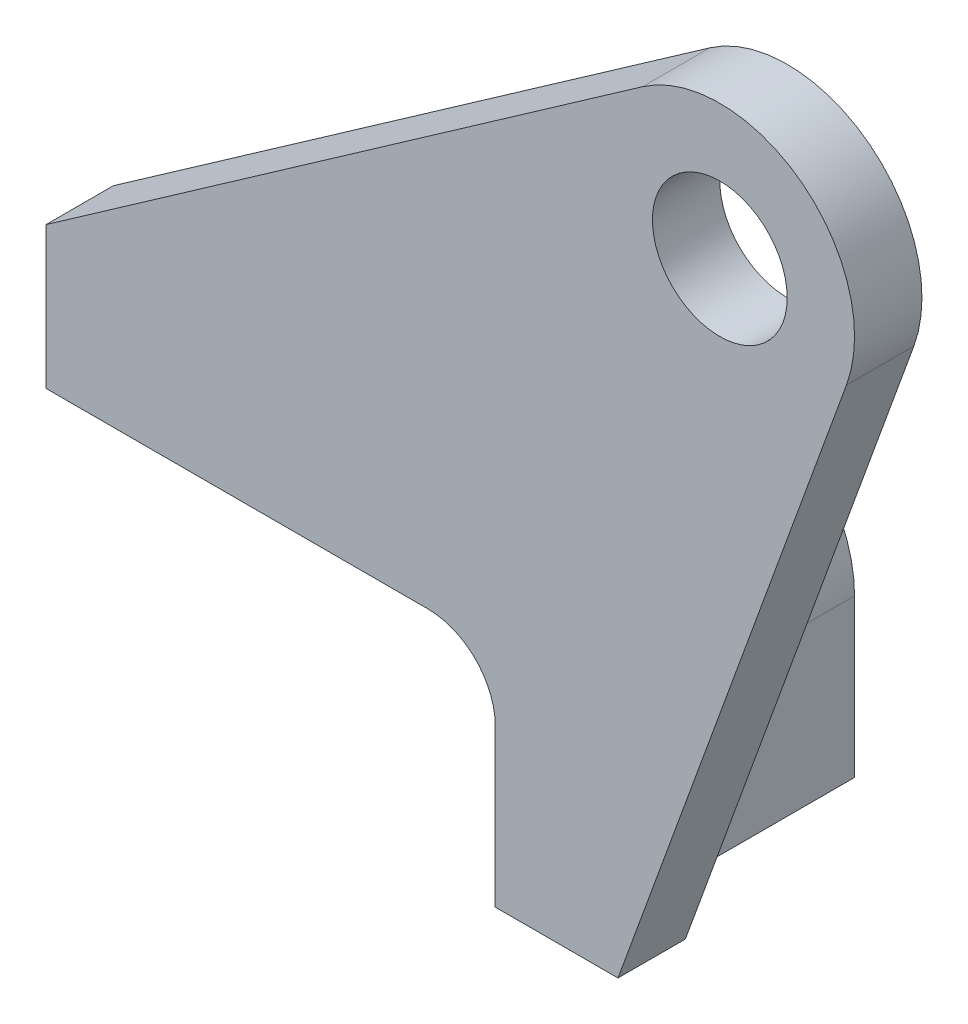
from build123d import *

# Parameters (mm, degrees)
SKETCH_1_R      = 6
EXTRUDE_1_DEPTH = 6
EXTRUDE_START   = -20
EXTRUDE_2_DEPTH = 20
FILLET_1_R      = 4


with BuildPart() as part:
    # Эскиз1 → Бобышка-Вытянуть1 (new body)
    with BuildSketch(Plane.XY):
        with BuildLine():
            Line((-40, 0), (-6, 0))
            ThreePointArc((-6, 0), (-1.757359313, -1.757359313), (0, -6))
            Line((0, -6), (0, -20))
            Line((0, -20), (10.931919214, -20))
            Line((10.931919214, -20), (31.276311449, 35.89575828))
            ThreePointArc((31.276311449, 35.89575828), (27.305137148, 49.520240083), (13.117082764, 49.829824531))
            Line((13.117082764, 49.829824531), (-40, 12.636842773))
            Line((-40, 12.636842773), (-40, 0))
        make_face()
        with Locations((20, 40)):
            Circle(SKETCH_1_R, mode=Mode.SUBTRACT)
    extrude(amount=EXTRUDE_1_DEPTH)

    # Эскиз2 → Бобышка-Вытянуть2 (add)
    with BuildSketch(Plane.XY.offset(EXTRUDE_START)):
        with BuildLine():
            Line((-40, 0), (-6, 0))
            ThreePointArc((-6, 0), (-1.757359313, -1.757359313), (0, -6))
            Line((0, -6), (0, -20))
            Line((0, -20), (6, -20))
            Line((6, -20), (6, -6))
            ThreePointArc((6, -6), (2.485281374, 2.485281374), (-6, 6))
            Line((-6, 6), (-40, 6))
            Line((-40, 6), (-40, 0))
        make_face()
    extrude(amount=EXTRUDE_2_DEPTH)

    # Скругление1
    fillet_1_edges = [part.edges().sort_by_distance(p)[0] for p in [
        (6, -13, 0),
        (2.485281374, 2.485281374, 0),
        (-23, 6, 0),
    ]]
    fillet(fillet_1_edges, radius=FILLET_1_R)


solid = part.part
